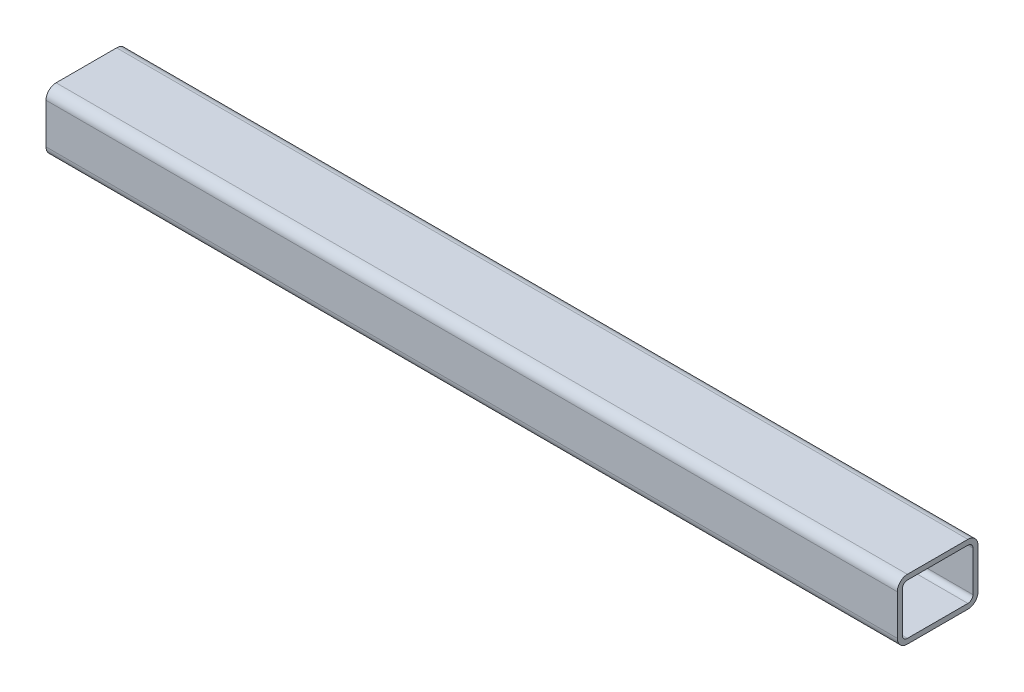
from build123d import *

# Parameters (mm, degrees)
EXTRUDE_1_DEPTH = 422


with BuildPart() as part:
    # Sketch 187 → 凸台-拉伸1 (new, symmetric)
    with BuildSketch(Plane(origin=(0, 0, 0), x_dir=(0, 0, -1), z_dir=(1, 0, 0))):
        with BuildLine():
            Line((-30, 30), (30, 30))
            ThreePointArc((30, 30), (37.071067812, 27.071067812), (40, 20))
            Line((40, 20), (40, -20))
            ThreePointArc((40, -20), (37.071067812, -27.071067812), (30, -30))
            Line((30, -30), (-30, -30))
            ThreePointArc((-30, -30), (-37.071067812, -27.071067812), (-40, -20))
            Line((-40, -20), (-40, 20))
            ThreePointArc((-40, 20), (-37.071067812, 27.071067812), (-30, 30))
        make_face()
        with BuildLine():
            Line((-30, 25), (30, 25))
            ThreePointArc((30, 25), (33.535533906, 23.535533906), (35, 20))
            Line((35, 20), (35, -20))
            ThreePointArc((35, -20), (33.535533906, -23.535533906), (30, -25))
            Line((30, -25), (-30, -25))
            ThreePointArc((-30, -25), (-33.535533906, -23.535533906), (-35, -20))
            Line((-35, -20), (-35, 20))
            ThreePointArc((-35, 20), (-33.535533906, 23.535533906), (-30, 25))
        make_face(mode=Mode.SUBTRACT)
    extrude(amount=EXTRUDE_1_DEPTH, both=True)


solid = part.part
